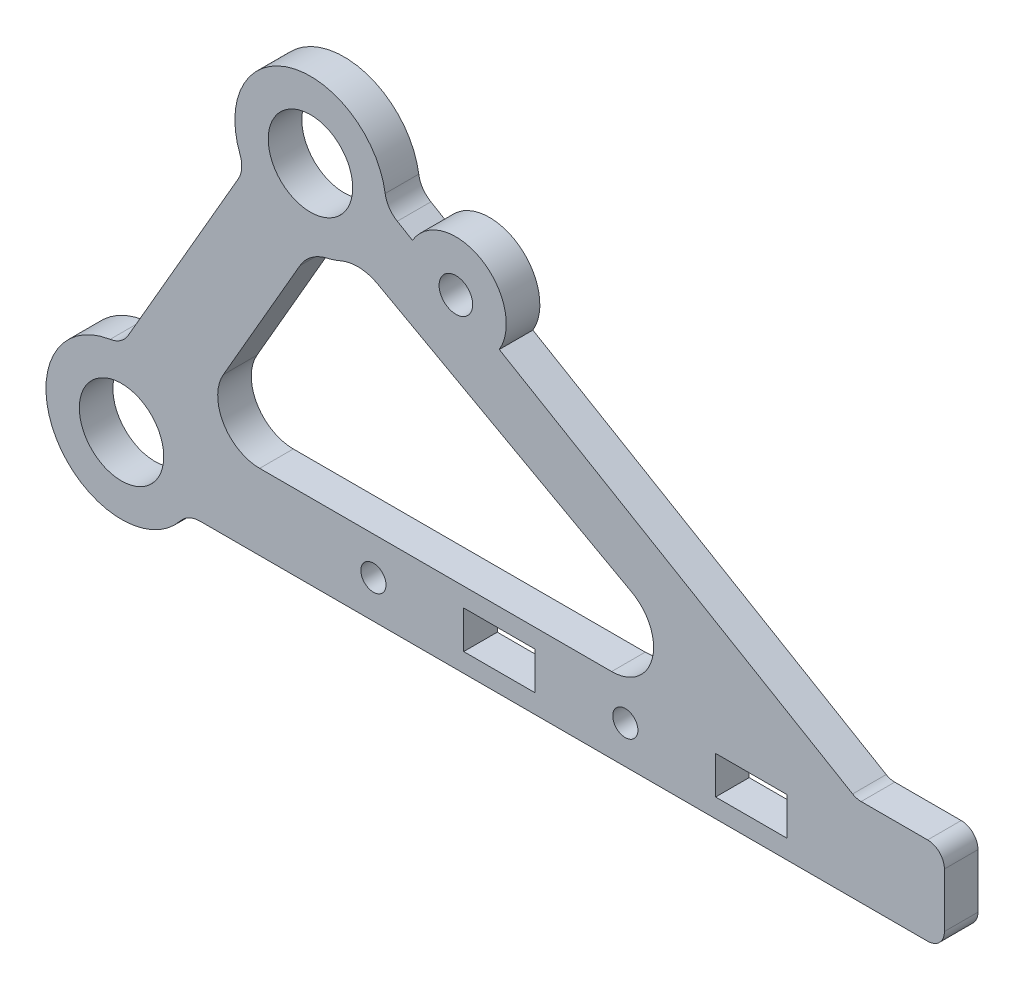
from build123d import *

# Parameters (mm, degrees)
SKETCH_1_R          = 5.03
SKETCH_1_R_2        = 1.5
SKETCH_1_W          = 8.5
SKETCH_1_H          = 4.5
EXTRUDE_1_DEPTH     = 4
SKETCH_2_R          = 6
EXTRUDE_2_DEPTH     = 4
SKETCH_3_R          = 2
CUT_EXTRUDE_1_DEPTH = 4


with BuildPart() as part:
    # 草图1 → 凸台-拉伸1 (new body)
    with BuildSketch(Plane.XY):
        with BuildLine():
            Line((87, -4.5), (9.367496998, -4.5))
            ThreePointArc((9.367496998, -4.5), (8.068458892, -4.795836543), (7.025622748, -5.625))
            ThreePointArc((7.025622748, -5.625), (-7.794228634, -4.5), (-1.358581522, 8.896867777))
            ThreePointArc((-1.358581522, 8.896867777), (-0.119086833, 9.385408641), (0.786634182, 10.36249037))
            Line((0.786634182, 10.36249037), (13.919137184, 33.108652801))
            ThreePointArc((13.919137184, 33.108652801), (14.312454275, 34.381571072), (14.11579573, 35.699275393))
            ThreePointArc((14.11579573, 35.699275393), (20.177098522, 47.666206639), (31.398879943, 40.316481698))
            ThreePointArc((31.398879943, 40.316481698), (31.879352208, 39.085435776), (32.842164256, 38.180272466))
            Line((32.842164256, 38.180272466), (87.068435314, 6.227425402))
            ThreePointArc((87.068435314, 6.227425402), (87.55756519, 6.02099445), (88.083774649, 5.950529007))
            Line((88.083774649, 5.950529007), (96, 5.950529007))
            ThreePointArc((96, 5.950529007), (97.414213562, 5.364742569), (98, 3.950529007))
            Line((98, 3.950529007), (98, 0))
            Line((98, 0), (98, -2.5))
            ThreePointArc((98, -2.5), (97.414213562, -3.914213562), (96, -4.5))
            Line((96, -4.5), (87, -4.5))
        make_face()
        Circle(SKETCH_1_R, mode=Mode.SUBTRACT)
        with Locations((22.5, 38.97114317)):
            Circle(SKETCH_1_R, mode=Mode.SUBTRACT)
        with Locations((30, 0)):
            Circle(SKETCH_1_R_2, mode=Mode.SUBTRACT)
        with Locations((60, 0)):
            Circle(SKETCH_1_R_2, mode=Mode.SUBTRACT)
        with Locations((45, 0)):
            Rectangle(SKETCH_1_W, SKETCH_1_H, mode=Mode.SUBTRACT)
        with BuildLine():
            Line((21.255373367, 27.815386605), (12.124355653, 12))
            ThreePointArc((12.124355653, 12), (12.124355653, 7), (16.454482672, 4.5))
            Line((16.454482672, 4.5), (58.367468971, 4.5))
            ThreePointArc((58.367468971, 4.5), (63.210197148, 8.25582003), (60.777559131, 13.880806481))
            Line((60.777559131, 13.880806481), (30.521886072, 30.525892321))
            ThreePointArc((30.521886072, 30.525892321), (28.338019103, 31.139965525), (26.107583087, 30.725820601))
            ThreePointArc((26.107583087, 30.725820601), (25.308251431, 30.420486827), (24.483535962, 30.192442521))
            ThreePointArc((24.483535962, 30.192442521), (22.620790776, 29.341612745), (21.255373367, 27.815386605))
        make_face(mode=Mode.SUBTRACT)
        with Locations((75, 0)):
            Rectangle(SKETCH_1_W, SKETCH_1_H, mode=Mode.SUBTRACT)
    extrude(amount=EXTRUDE_1_DEPTH)

    # 草图2 → 凸台-拉伸2 (add)
    with BuildSketch(Plane.XY.offset(4)):
        with Locations((39.819566523, 34.068836013)):
            Circle(SKETCH_2_R)
    extrude(amount=-EXTRUDE_2_DEPTH)

    # 草图3 → 切除-拉伸1 (cut)
    with BuildSketch(Plane.XY.offset(4)):
        with Locations((39.819566523, 34.068836013)):
            Circle(SKETCH_3_R)
    extrude(amount=-CUT_EXTRUDE_1_DEPTH, mode=Mode.SUBTRACT)


solid = part.part
